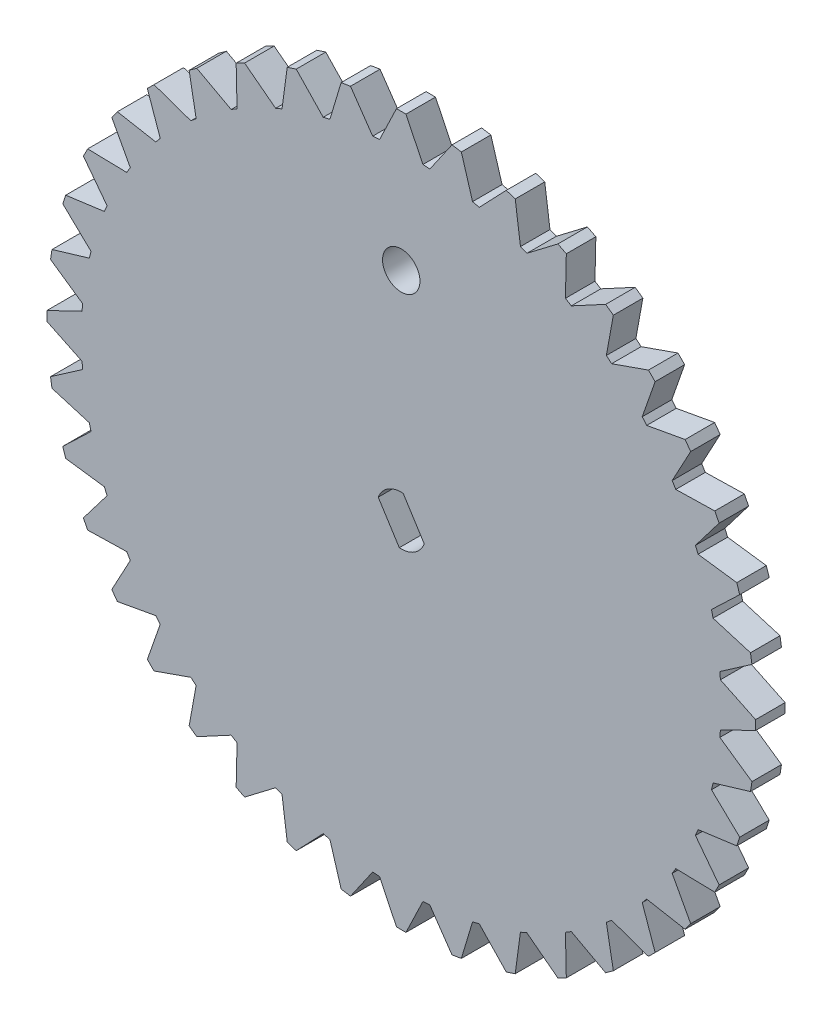
from build123d import *

# Parameters (mm, degrees)
SKETCH1_R           = 32.5
BOSS_EXTRUDE1_DEPTH = 3
BOSS_EXTRUDE6_DEPTH = 3
CUT_EXTRUDE1_DEPTH  = 3
SKETCH5_R           = 7
BOSS_EXTRUDE7_DEPTH = 3
SKETCH7_R           = 1.9
CUT_EXTRUDE2_DEPTH  = 3


with BuildPart() as part:
    # Sketch1 → Boss-Extrude1 (new body)
    with BuildSketch(Plane.XY):
        Circle(SKETCH1_R)
    extrude(amount=BOSS_EXTRUDE1_DEPTH)

    # Sketch2 → Boss-Extrude6 (add)
    with BuildSketch(Plane.XY.offset(3)):
        Polygon((-0.480921932, 36), (-2.2, 32.425452965), (2.2, 32.425452965), (0.480921932, 36), align=None)
        Polygon((6.106641727, 35.481547496), (7.245372738, 31.682086009), (2.899544039, 32.370397655), (5.156639756, 35.632013027), align=None)
        Polygon((11.581995735, 34.089421537), (12.112340352, 30.158600949), (7.927691681, 31.518275724), (10.66722786, 34.386647637), align=None)
        Polygon((16.77216257, 31.857900882), (16.681061949, 27.892511042), (12.760633243, 29.890069241), (15.915153411, 32.294568859), align=None)
        Polygon((21.549343099, 28.841932978), (20.839040439, 24.939614944), (17.279365664, 27.525870054), (20.771195066, 29.407290617), align=None)
        Polygon((25.795907282, 25.115780963), (24.483892593, 21.372622756), (21.372622756, 24.483892593), (25.115780963, 25.795907282), align=None)
        Polygon((29.407290617, 20.771195066), (27.525870054, 17.279365664), (24.939614944, 20.83904044), (28.841932978, 21.549343099), align=None)
        Polygon((32.294568859, 15.915153411), (29.890069241, 12.760633243), (27.892511042, 16.681061949), (31.857900882, 16.77216257), align=None)
        Polygon((34.386647637, 10.66722786), (31.518275724, 7.927691681), (30.158600949, 12.112340352), (34.089421537, 11.581995735), align=None)
        Polygon((35.632013027, 5.156639756), (32.370397655, 2.899544039), (31.682086009, 7.245372738), (35.481547496, 6.106641727), align=None)
        Polygon((36, -0.480921932), (32.425452965, -2.2), (32.425452965, 2.2), (36, 0.480921932), align=None)
        Polygon((35.481547496, -6.106641727), (31.682086009, -7.245372738), (32.370397655, -2.899544039), (35.632013027, -5.156639756), align=None)
        Polygon((34.089421537, -11.581995735), (30.158600949, -12.112340352), (31.518275724, -7.927691681), (34.386647637, -10.66722786), align=None)
        Polygon((31.857900882, -16.77216257), (27.892511042, -16.681061949), (29.890069241, -12.760633243), (32.294568859, -15.915153411), align=None)
        Polygon((28.841932978, -21.549343099), (24.939614944, -20.839040439), (27.525870054, -17.279365664), (29.407290617, -20.771195066), align=None)
        Polygon((25.115780963, -25.795907282), (21.372622756, -24.483892593), (24.483892593, -21.372622756), (25.795907282, -25.115780963), align=None)
        Polygon((20.771195066, -29.407290617), (17.279365664, -27.525870054), (20.83904044, -24.939614944), (21.549343099, -28.841932978), align=None)
        Polygon((15.915153411, -32.294568859), (12.760633243, -29.890069241), (16.681061949, -27.892511042), (16.77216257, -31.857900882), align=None)
        Polygon((10.66722786, -34.386647637), (7.927691681, -31.518275724), (12.112340352, -30.158600949), (11.581995735, -34.089421537), align=None)
        Polygon((5.156639756, -35.632013027), (2.899544039, -32.370397655), (7.245372738, -31.682086009), (6.106641727, -35.481547496), align=None)
        Polygon((-0.480921932, -36), (-2.2, -32.425452965), (2.2, -32.425452965), (0.480921932, -36), align=None)
        Polygon((-6.106641727, -35.481547496), (-7.245372738, -31.682086009), (-2.899544039, -32.370397655), (-5.156639756, -35.632013027), align=None)
        Polygon((-11.581995735, -34.089421537), (-12.112340352, -30.158600949), (-7.927691681, -31.518275724), (-10.66722786, -34.386647637), align=None)
        Polygon((-16.77216257, -31.857900882), (-16.681061949, -27.892511042), (-12.760633243, -29.890069241), (-15.915153411, -32.294568859), align=None)
        Polygon((-21.549343099, -28.841932978), (-20.839040439, -24.939614944), (-17.279365664, -27.525870054), (-20.771195066, -29.407290617), align=None)
        Polygon((-25.795907282, -25.115780963), (-24.483892593, -21.372622756), (-21.372622756, -24.483892593), (-25.115780963, -25.795907282), align=None)
        Polygon((-29.407290617, -20.771195066), (-27.525870054, -17.279365664), (-24.939614944, -20.83904044), (-28.841932978, -21.549343099), align=None)
        Polygon((-32.294568859, -15.915153411), (-29.890069241, -12.760633243), (-27.892511042, -16.681061949), (-31.857900882, -16.77216257), align=None)
        Polygon((-34.386647637, -10.66722786), (-31.518275724, -7.927691681), (-30.158600949, -12.112340352), (-34.089421537, -11.581995735), align=None)
        Polygon((-35.632013027, -5.156639756), (-32.370397655, -2.899544039), (-31.682086009, -7.245372738), (-35.481547496, -6.106641727), align=None)
        Polygon((-36, 0.480921932), (-32.425452965, 2.2), (-32.425452965, -2.2), (-36, -0.480921932), align=None)
        Polygon((-35.481547496, 6.106641727), (-31.682086009, 7.245372738), (-32.370397655, 2.899544039), (-35.632013027, 5.156639756), align=None)
        Polygon((-34.089421537, 11.581995735), (-30.158600949, 12.112340352), (-31.518275724, 7.927691681), (-34.386647637, 10.66722786), align=None)
        Polygon((-31.857900882, 16.77216257), (-27.892511042, 16.681061949), (-29.890069241, 12.760633243), (-32.294568859, 15.915153411), align=None)
        Polygon((-28.841932978, 21.549343099), (-24.939614944, 20.839040439), (-27.525870054, 17.279365664), (-29.407290617, 20.771195066), align=None)
        Polygon((-25.115780963, 25.795907282), (-21.372622756, 24.483892593), (-24.483892593, 21.372622756), (-25.795907282, 25.115780963), align=None)
        Polygon((-20.771195066, 29.407290617), (-17.279365664, 27.525870054), (-20.839040439, 24.939614944), (-21.549343099, 28.841932978), align=None)
        Polygon((-15.915153411, 32.294568859), (-12.760633243, 29.890069241), (-16.681061949, 27.892511042), (-16.77216257, 31.857900882), align=None)
        Polygon((-10.66722786, 34.386647637), (-7.927691681, 31.518275724), (-12.112340352, 30.158600949), (-11.581995735, 34.089421537), align=None)
        Polygon((-5.156639756, 35.632013027), (-2.899544039, 32.370397655), (-7.245372738, 31.682086009), (-6.106641727, 35.481547496), align=None)
    extrude(amount=-BOSS_EXTRUDE6_DEPTH)

    # Sketch3 → Cut-Extrude1 (cut)
    with BuildSketch(Plane.XY.offset(3)):
        with BuildLine():
            Line((-2.337034435, 0.887845736), (-0.197962265, -2.492149863))
            ThreePointArc((-0.197962265, -2.492149863), (1.336920106, -2.11249725), (2.337034435, -0.887845736))
            Line((2.337034435, -0.887845736), (0.197962265, 2.492149863))
            ThreePointArc((0.197962265, 2.492149863), (-1.336920106, 2.11249725), (-2.337034435, 0.887845736))
        make_face()
    extrude(amount=-CUT_EXTRUDE1_DEPTH, mode=Mode.SUBTRACT)

    # Sketch5 → Boss-Extrude7 (add)
    with BuildSketch(Plane(origin=(0, 0, 0), x_dir=(-1, 0, 0), z_dir=(0, 0, -1))):
        with Locations(Location((0, 0, 0), (0, 0, 180))):
            Circle(SKETCH5_R)
        with BuildLine():
            Line((-0.197962265, 2.492149863), (-2.337034435, -0.887845736))
            ThreePointArc((-2.337034435, -0.887845736), (-1.336920106, -2.11249725), (0.197962265, -2.492149863))
            Line((0.197962265, -2.492149863), (2.337034435, 0.887845736))
            ThreePointArc((2.337034435, 0.887845736), (1.336920106, 2.11249725), (-0.197962265, 2.492149863))
        make_face(mode=Mode.SUBTRACT)
    extrude(amount=BOSS_EXTRUDE7_DEPTH)

    # Sketch7 → Cut-Extrude2 (cut)
    with BuildSketch(Plane.XY.offset(3)):
        with Locations((0, 22)):
            Circle(SKETCH7_R)
    extrude(amount=-CUT_EXTRUDE2_DEPTH, mode=Mode.SUBTRACT)


solid = part.part
